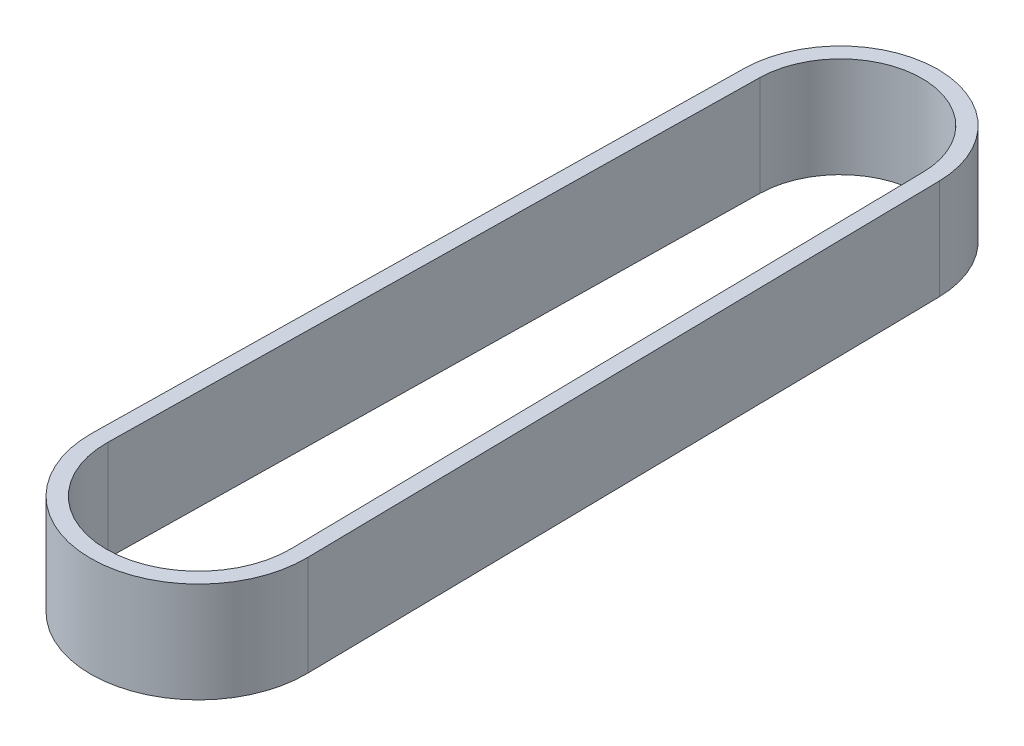
from build123d import *

# Parameters (mm, degrees)
BOSS_EXTRU_1_DEPTH = 3.175


with BuildPart() as part:
    # Esquisse1 → Boss.-Extru.1 (new, symmetric)
    with BuildSketch(Plane(origin=(0, 0, 0), x_dir=(1, 0, 0), z_dir=(0, 1, 0))):
        with BuildLine():
            Line((6.819140792, -11.99174635), (6.174222052, 28.63313494))
            ThreePointArc((6.174222052, 28.63313494), (0, 34.710119355), (-6.174222052, 28.63313494))
            Line((-6.174222052, 28.63313494), (-6.819140792, -11.99174635))
            ThreePointArc((-6.819140792, -11.99174635), (0, -18.92), (6.819140792, -11.99174635))
        make_face()
        with BuildLine():
            Line((5.819266776, -12.007619319), (5.174348035, 28.617261971))
            ThreePointArc((5.174348035, 28.617261971), (0, 33.710119355), (-5.174348035, 28.617261971))
            Line((-5.174348035, 28.617261971), (-5.819266776, -12.007619319))
            ThreePointArc((-5.819266776, -12.007619319), (0, -17.92), (5.819266776, -12.007619319))
        make_face(mode=Mode.SUBTRACT)
    extrude(amount=BOSS_EXTRU_1_DEPTH, both=True)


solid = part.part
